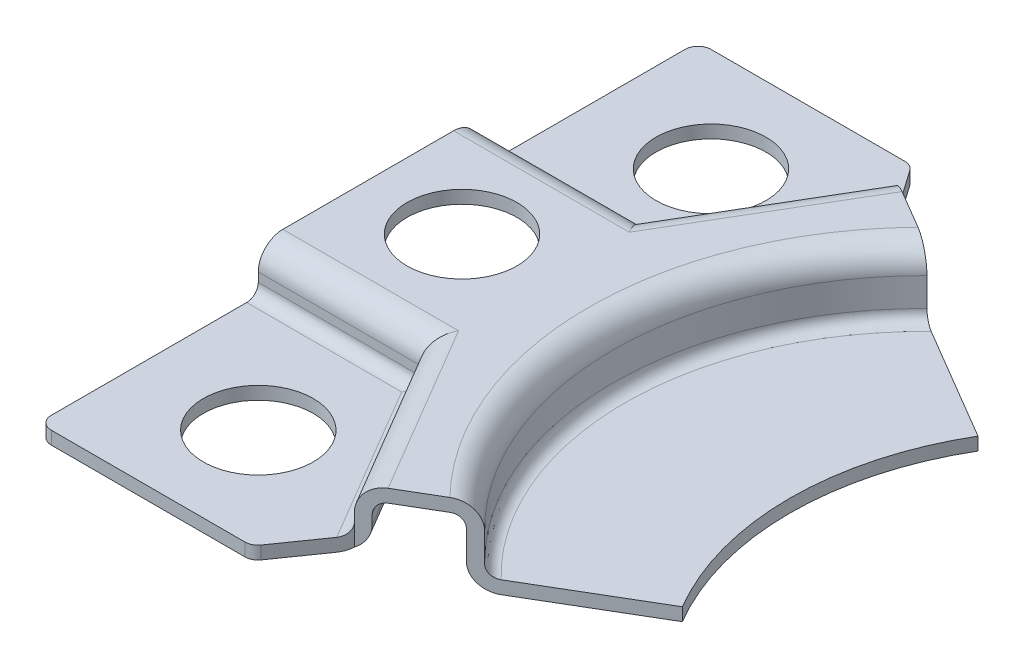
from build123d import *

# Parameters (mm, degrees)
SKETCH_1_R           = 8.5
EXTRUDE_1_DEPTH      = 2
EXTRUDE_1_2_DEPTH    = 2
EXTRUDE_7_DEPTH      = 5
EXTRUDE_7_DEPTH_BACK = 2
EXTRUDE_8_DEPTH      = 2
FILLET_1_R           = 3.8
FILLET_2_R           = 1.8
SKETCH_5_R           = 8.500000000000004
CUT_EXTRUDE_1_DEPTH  = 2
EXTRUDE_START        = 8
EXTRUDE_9_DEPTH      = 8
EXTRUDE_START_2      = 2
EXTRUDE_10_DEPTH     = 2
FILLET_3_R           = 1.8
FILLET_4_R           = 3.8
FILLET_5_R           = 2


with BuildPart() as part:
    # Эскиз1 → Бобышка-Вытянуть1 (new body)
    with BuildSketch(Plane(origin=(0, 0, 0), x_dir=(1, 0, 0), z_dir=(0, 1, 0))):
        Polygon((0, 0), (25, 0), (39.53977757143407, 24.66022969681975), (33, 34), (0, 34), align=None)
        with Locations(Location((18, 18.000000000000004, 0), (0, 0, 270))):
            Circle(SKETCH_1_R, mode=Mode.SUBTRACT)
    extrude(amount=EXTRUDE_1_DEPTH)



with BuildPart() as body_2:
    # Эскиз1 → Extrude 1 2 (new body)
    with BuildSketch(Plane(origin=(0, 0, 0), x_dir=(1, 0, 0), z_dir=(0, 1, 0))):
        Polygon((39.539777571434044, -58.66022969681975), (32.99999999999997, -68), (-1.388e-14, -68), (-1.388e-14, -34), (24.999999999999975, -34), align=None)
        with Locations(Location((17.99999999999997, -52.00000000000001, 0), (0, 0, 90))):
            Circle(SKETCH_1_R, mode=Mode.SUBTRACT)
    extrude(amount=EXTRUDE_1_2_DEPTH)


with BuildPart() as part_1:
    add(part.part)

    add(body_2.part)  # Бобышка-Вытянуть7 merges body 2
    # Эскиз2 → Бобышка-Вытянуть7 (add, two sides: drawn at the far end of the back side and taken through both)
    with BuildSketch(Plane(origin=(0, 2, 0), x_dir=(1, 0, 0), z_dir=(0, 1, 0)).offset(-EXTRUDE_7_DEPTH_BACK)):
        Polygon((0, 0), (2.4e-16, -2), (26.142543519238394, -1.9999999999999973), (41.262614368883476, 23.64443770563539), (39.53977757143407, 24.66022969681975), (25, 0), align=None)
        Polygon((-1.388e-14, -34), (24.999999999999975, -34), (39.539777571434044, -58.66022969681975), (41.26261436888351, -57.644437705635355), (26.142543519238462, -32), (0, -32), align=None)
    extrude(amount=EXTRUDE_7_DEPTH + EXTRUDE_7_DEPTH_BACK)

    # Эскиз4 → Бобышка-Вытянуть8 (add)
    with BuildSketch(Plane(origin=(0, 7, 0), x_dir=(1, 0, 0), z_dir=(0, 1, 0))):
        with BuildLine():
            Line((-1.388e-14, -34), (24.999999999999922, -34.00000000000004))
            Line((24.999999999999922, -34.00000000000004), (39.539777571434044, -58.66022969681975))
            Line((39.539777571434044, -58.66022969681975), (52.19877033120313, -51.196433079013936))
            ThreePointArc((52.19877033120313, -51.196433079013936), (37.882653193375084, -16.999999999999993), (52.19877033120313, 17.196433079013932))
            Line((52.19877033120313, 17.196433079013932), (39.539777571434044, 24.660229696819748))
            Line((39.539777571434044, 24.660229696819748), (24.999999999999982, 0))
            Line((24.999999999999982, 0), (-1.388e-14, 0))
            Line((-1.388e-14, 0), (-1.388e-14, -34))
        make_face()
    extrude(amount=EXTRUDE_8_DEPTH)

    # Скругление1
    fillet_1_edges = [part_1.edges().sort_by_distance(p)[0] for p in [
        (33.70257894406093, 0, -10.822218852817695),
        (33.70257894406099, 0, 44.82221885281768),
        (32.26988878571699, 9, 46.33011484840989),
        (12.499999999999954, 9, 34.00000000000002),
        (32.269888785717015, 9, -12.330114848409874),
        (12.499999999999984, 9, 0),
        (13.071271759619231, 0, 32),
        (13.071271759619197, 0, 1.9999999999999987),
    ]]
    fillet(fillet_1_edges, radius=FILLET_1_R)

    # Скругление2
    fillet_2_edges = [part_1.edges().sort_by_distance(p)[0] for p in [
        (32.269888785717036, 2, -12.330114848409876),
        (13.071271759619197, 7, 1.9999999999999987),
        (33.70257894406093, 7, -10.822218852817695),
        (32.26988878571701, 2, 46.33011484840988),
        (12.49999999999998, 2, 34),
        (33.70257894406099, 7, 44.82221885281768),
        (13.071271759619231, 7, 32),
        (12.5, 2, 0),
    ]]
    fillet(fillet_2_edges, radius=FILLET_2_R)

    # Эскиз5 → Вырез-Вытянуть1 (cut)
    with BuildSketch(Plane(origin=(0, 9.000000000000002, 0), x_dir=(1, 0, 0), z_dir=(0, 1, 0))):
        with Locations(Location((14.500000000000002, -17, 0), (0, 0, 270))):
            Circle(SKETCH_5_R)
    extrude(amount=-CUT_EXTRUDE_1_DEPTH, mode=Mode.SUBTRACT)

    # Эскиз6 → Бобышка-Вытянуть9 (add)
    with BuildSketch(Plane.XZ.offset(-7).offset(EXTRUDE_START)):
        with BuildLine():
            Line((52.19877033120314, -17.19643307901394), (50.41843679588763, -18.246125394320746))
            ThreePointArc((50.41843679588763, -18.246125394320746), (35.882653193375084, 17.000000000000007), (50.41843679588763, 52.24612539432075))
            Line((50.41843679588763, 52.24612539432075), (52.19877033120313, 51.196433079013936))
            ThreePointArc((52.19877033120313, 51.196433079013936), (37.882653193375084, 16.999999999999986), (52.19877033120314, -17.19643307901394))
        make_face()
    extrude(amount=-EXTRUDE_9_DEPTH)

    # Эскиз7 → Бобышка-Вытянуть10 (add)
    with BuildSketch(Plane.XZ.offset(1).offset(EXTRUDE_START_2)):
        with BuildLine():
            Line((50.41843679588763, 52.24612539432075), (71.4338966640132, 39.85531980164811))
            ThreePointArc((71.4338966640132, 39.85531980164811), (65.19772460662475, 17.000000000000007), (71.43389666401319, -5.8553198016480925))
            Line((71.43389666401319, -5.8553198016480925), (50.418436795887615, -18.24612539432073))
            ThreePointArc((50.418436795887615, -18.24612539432073), (35.882653193375084, 17.000000000000007), (50.41843679588763, 52.24612539432075))
        make_face()
    extrude(amount=-EXTRUDE_10_DEPTH)

    # Скругление3
    fillet_3_edges = [part_1.edges().sort_by_distance(p)[0] for p in [
        (35.88265319337508, 7, 17.000000000000007),
        (37.88265319337509, -1, 16.999999999999996),
    ]]
    fillet(fillet_3_edges, radius=FILLET_3_R)

    # Скругление4
    fillet_4_edges = [part_1.edges().sort_by_distance(p)[0] for p in [
        (35.88265319337508, -3, 17.000000000000014),
        (37.882653193375084, 9, 17.000000000000004),
    ]]
    fillet(fillet_4_edges, radius=FILLET_4_R)

    # Скругление5
    fillet_5_edges = [part_1.edges().sort_by_distance(p)[0] for p in [
        (-1.388e-14, 1, 68),
        (32.99999999999997, 1, 68),
        (0, 1, -34),
        (33, 1, -34),
    ]]
    fillet(fillet_5_edges, radius=FILLET_5_R)


solid = part_1.part
